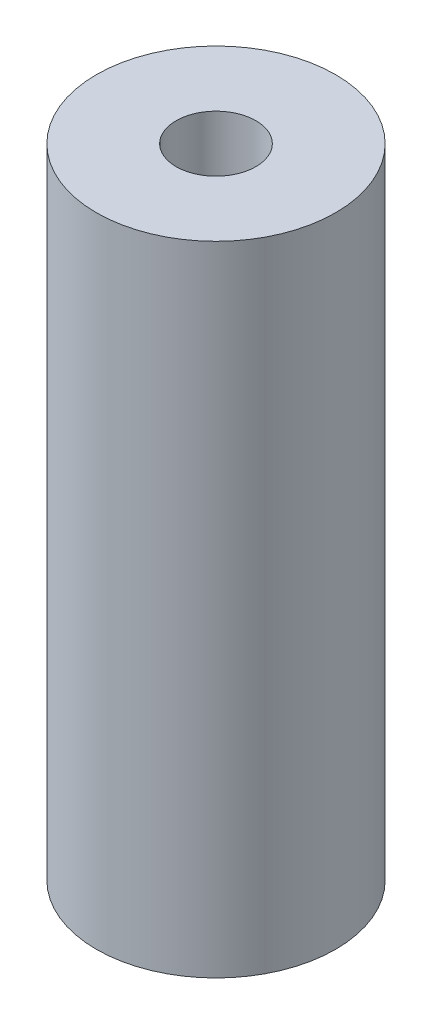
from build123d import *

# Parameters (mm, degrees)
SKETCH1_R           = 4.5
SKETCH1_R_2         = 1.5
BOSS_EXTRUDE1_DEPTH = 24


with BuildPart() as part:
    # Sketch1 → Boss-Extrude1 (new body)
    with BuildSketch(Plane(origin=(0, 0, 0), x_dir=(1, 0, 0), z_dir=(0, 1, 0))):
        with Locations(Location((0, 0, 0), (0, 0, 270))):
            Circle(SKETCH1_R)
        with Locations(Location((0, 0, 0), (0, 0, 270))):
            Circle(SKETCH1_R_2, mode=Mode.SUBTRACT)
    extrude(amount=BOSS_EXTRUDE1_DEPTH)


solid = part.part
